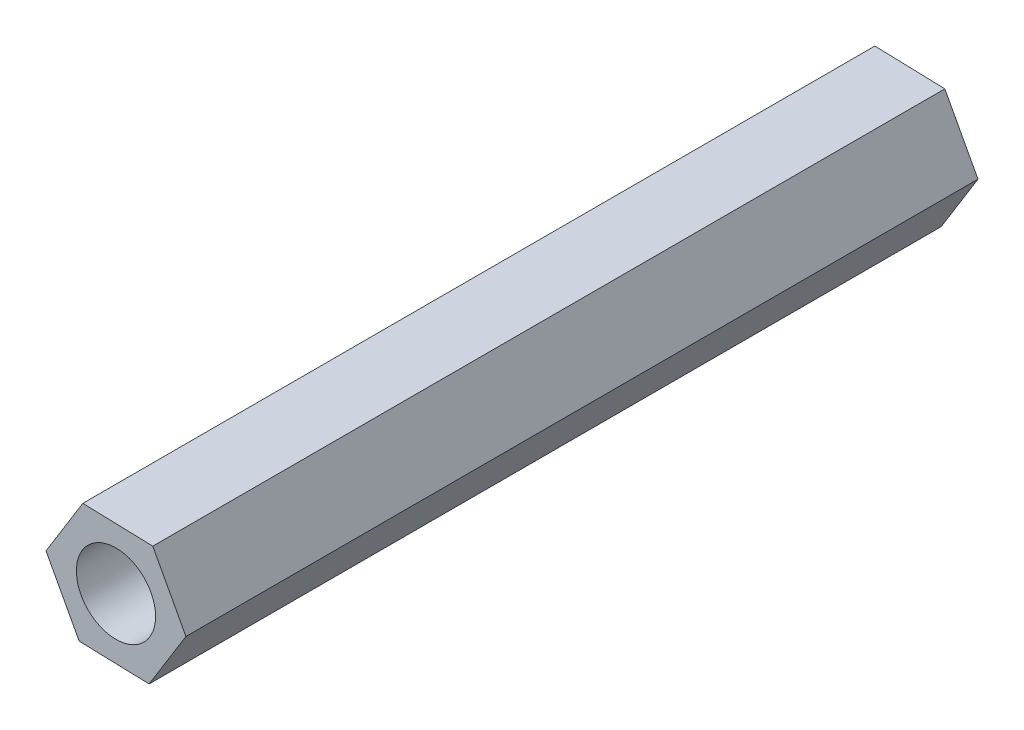
from build123d import *

# Parameters (mm, degrees)
SKETCH1_R           = 1.5
BOSS_EXTRUDE1_DEPTH = 30


with BuildPart() as part:
    # Sketch1 → Boss-Extrude1 (new body)
    with BuildSketch(Plane.XY):
        Polygon((1.255972374, -2.334820439), (2.65, -0.079706237), (1.394027626, 2.255114201), (-1.255972374, 2.334820439), (-2.65, 0.079706237), (-1.394027626, -2.255114201), align=None)
        Circle(SKETCH1_R, mode=Mode.SUBTRACT)
    extrude(amount=BOSS_EXTRUDE1_DEPTH)


solid = part.part
